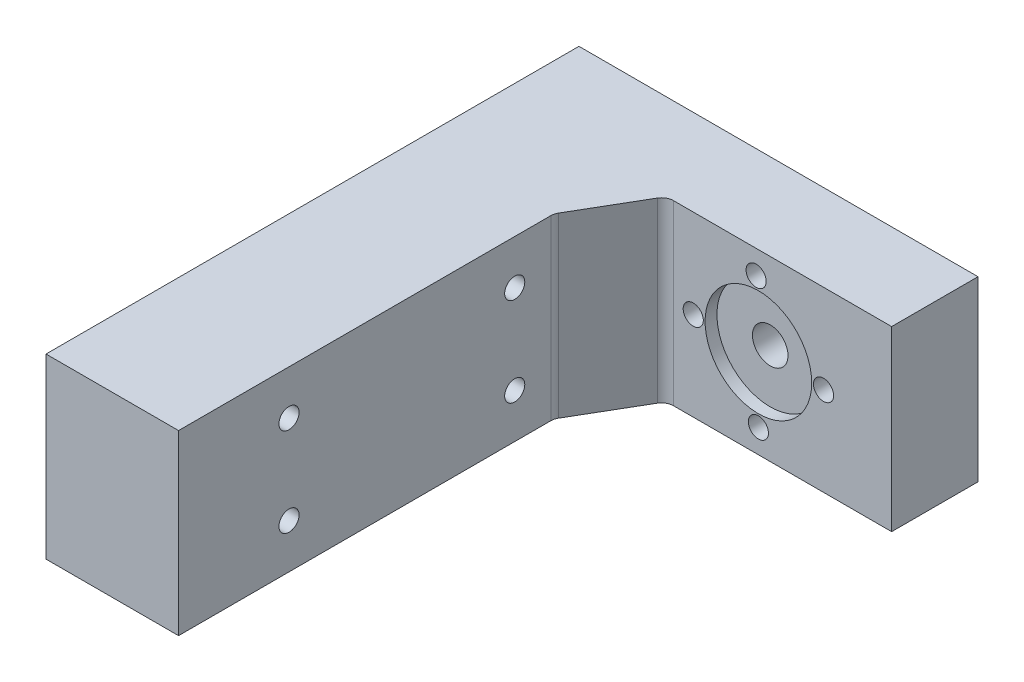
from build123d import *

# Parameters (mm, degrees)
BOSS_EXTRUDE1_DEPTH = 300
SKETCH3_R           = 17
SKETCH3_R_2         = 30
CUT_EXTRUDE1_DEPTH  = 1055.907875982
SKETCH4_R           = 90
CUT_EXTRUDE2_DEPTH  = 20
SKETCH5_R           = 17
CUT_EXTRUDE3_DEPTH  = 1051
CHAMFER1_SIZE       = 70
CHAMFER1_SIZE2      = 120
FILLET1_R           = 20


with BuildPart() as part:
    # Sketch2 → Boss-Extrude1 (new body)
    with BuildSketch(Plane(origin=(0, 0, 0), x_dir=(-1, 0, 0), z_dir=(0, 1, 0))):
        Polygon((0, 0), (673.85334868, 0), (673.85334868, 900), (450, 900), (450, 145.843324447), (0, 145.843324447), align=None)
    extrude(amount=BOSS_EXTRUDE1_DEPTH)

    # Sketch3 → Cut-Extrude1 (cut, through all)
    with BuildSketch(Plane.XY.offset(145.843324447)):
        with Locations((-335, 150)):
            Circle(SKETCH3_R)
        with Locations((-228.822978678, 259.933547355)):
            Circle(SKETCH3_R)
        with Locations((-115, 150)):
            Circle(SKETCH3_R)
        with Locations((-225, 40)):
            Circle(SKETCH3_R)
        with Locations((-225, 150)):
            Circle(SKETCH3_R_2)
    extrude(amount=-CUT_EXTRUDE1_DEPTH, mode=Mode.SUBTRACT)

    # Sketch4 → Cut-Extrude2 (cut)
    with BuildSketch(Plane.XY.offset(145.843324447)):
        with Locations((-225, 150)):
            Circle(SKETCH4_R)
    extrude(amount=-CUT_EXTRUDE2_DEPTH, mode=Mode.SUBTRACT)

    # Sketch5 → Cut-Extrude3 (cut, through all)
    with BuildSketch(Plane.YZ.offset(-450)):
        with Locations(Location((75, 713.5, 0), (0, 0, 270))):
            Circle(SKETCH5_R)
        with Locations(Location((225, 713.5, 0), (0, 0, 270))):
            Circle(SKETCH5_R)
        with Locations(Location((75, 332.343324447, 0), (0, 0, 270))):
            Circle(SKETCH5_R)
        with Locations(Location((225, 332.343324447, 0), (0, 0, 270))):
            Circle(SKETCH5_R)
    extrude(amount=-CUT_EXTRUDE3_DEPTH, mode=Mode.SUBTRACT)

    # Chamfer1
    chamfer1_edges = [part.edges().sort_by_distance(p)[0] for p in [
        (-450, 150, 145.843324447),
    ]]
    chamfer1_side = [part.faces().sort_by_distance(p)[0] for p in [
        (-444.591673087, 150, 145.843324447),
    ]]
    chamfer(chamfer1_edges, length=CHAMFER1_SIZE, length2=CHAMFER1_SIZE2, reference=chamfer1_side[0])

    # Fillet1
    fillet1_edges = [part.edges().sort_by_distance(p)[0] for p in [
        (-380, 150, 145.843324447),
        (-450, 150, 265.843324447),
    ]]
    fillet(fillet1_edges, radius=FILLET1_R)


solid = part.part
